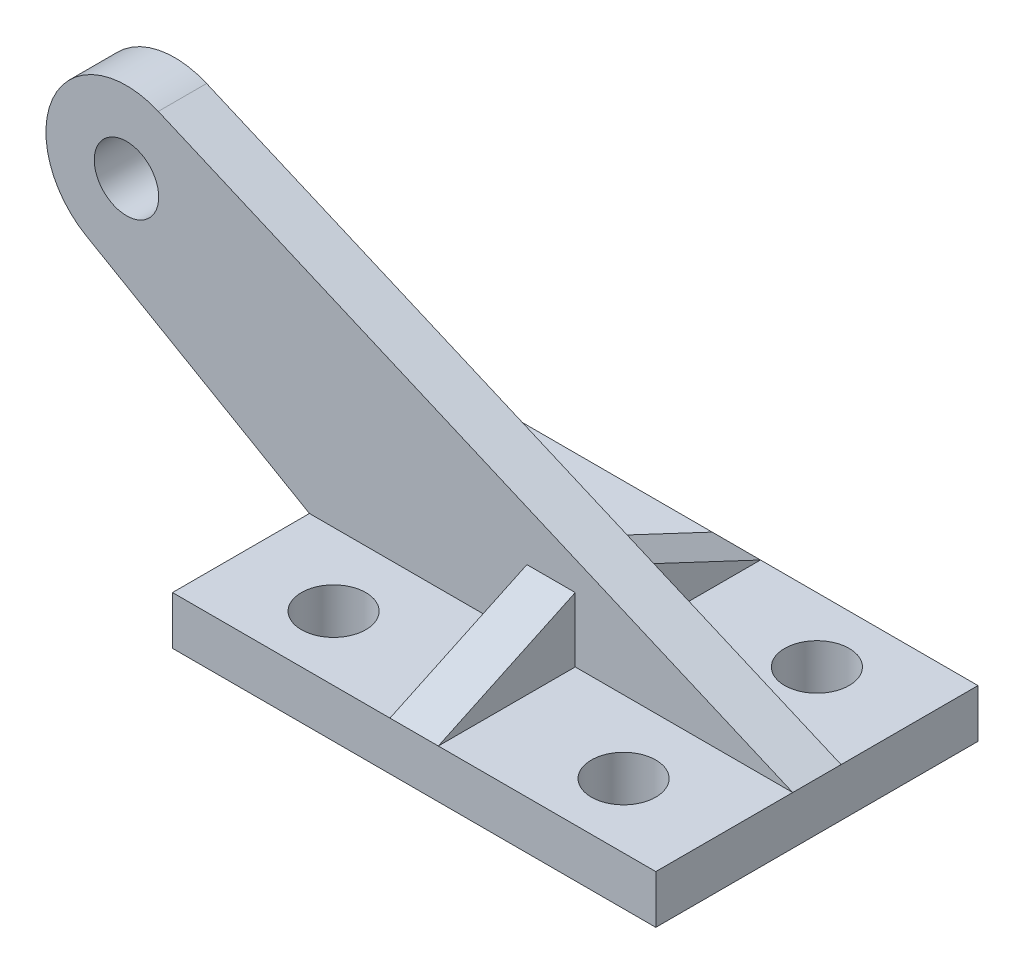
from build123d import *

# Parameters (mm, degrees)
SKETCH1_W           = 150
SKETCH1_H           = 100
SKETCH1_R           = 10
BOSS_EXTRUDE1_DEPTH = 15
SKETCH2_R           = 10
BOSS_EXTRUDE2_DEPTH = 7.5
BOSS_EXTRUDE3_DEPTH = 7.5


with BuildPart() as part:
    # Sketch1 → Boss-Extrude1 (new body)
    with BuildSketch(Plane(origin=(0, 0, 0), x_dir=(1, 0, 0), z_dir=(0, 1, 0))):
        Rectangle(SKETCH1_W, SKETCH1_H)
        with Locations(Location((-45, 30, 0), (0, 0, 270))):
            Circle(SKETCH1_R, mode=Mode.SUBTRACT)
        with Locations(Location((45, 30, 0), (0, 0, 270))):
            Circle(SKETCH1_R, mode=Mode.SUBTRACT)
        with Locations(Location((45, -30, 0), (0, 0, 270))):
            Circle(SKETCH1_R, mode=Mode.SUBTRACT)
        with Locations(Location((-45, -30, 0), (0, 0, 270))):
            Circle(SKETCH1_R, mode=Mode.SUBTRACT)
    extrude(amount=BOSS_EXTRUDE1_DEPTH)

    # Sketch2 → Boss-Extrude2 (add, symmetric)
    with BuildSketch(Plane.XY):
        with BuildLine():
            Line((75, 15), (-75, 15))
            Line((-75, 15), (-144.282032303, 55))
            ThreePointArc((-144.282032303, 55), (-154.13052805, 87.855309915), (-121.911493446, 99.61958071))
            Line((-121.911493446, 99.61958071), (75, 15))
        make_face()
        with Locations((-131.782032303, 76.650635095)):
            Circle(SKETCH2_R, mode=Mode.SUBTRACT)
    extrude(amount=BOSS_EXTRUDE2_DEPTH, both=True)

    # Sketch3 → Boss-Extrude3 (add, symmetric)
    with BuildSketch(Plane(origin=(0, 0, 0), x_dir=(0, 0, -1), z_dir=(1, 0, 0))):
        Polygon((-7.5, 35), (-7.5, 15), (-50, 15), align=None)
        Polygon((50, 15), (7.5, 35), (7.5, 15), align=None)
    extrude(amount=BOSS_EXTRUDE3_DEPTH, both=True)


solid = part.part
